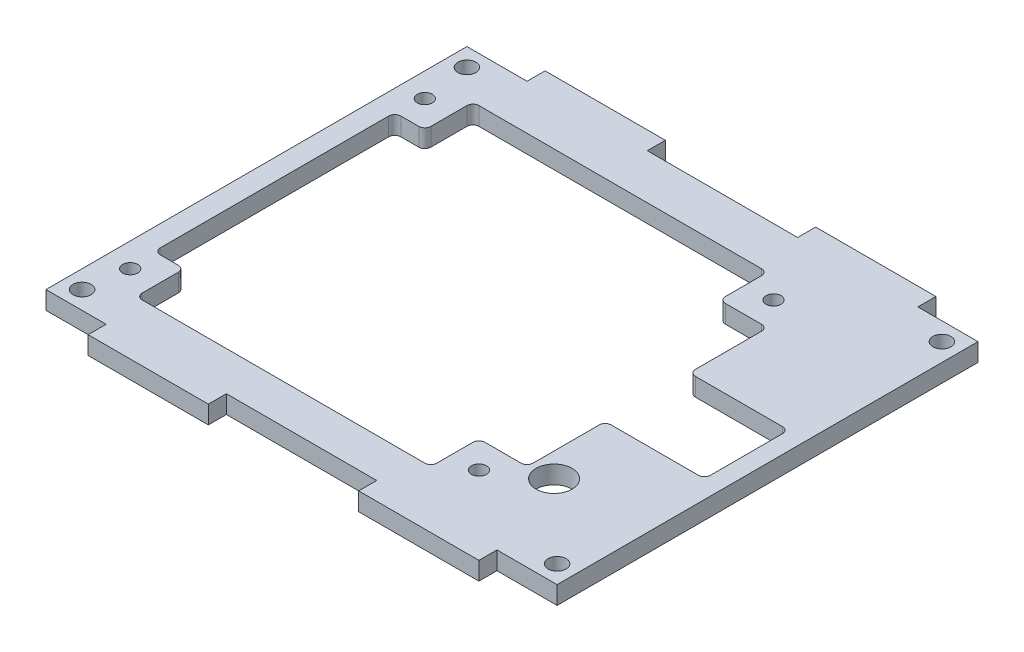
from build123d import *

# Parameters (mm, degrees)
SKETCH1_W           = 85
SKETCH1_H           = 70
BOSS_EXTRUDE1_DEPTH = 3
SKETCH2_R           = 1.25
CUT_EXTRUDE1_DEPTH  = 56.138462075
SKETCH3_W           = 20
SKETCH3_H           = 3
BOSS_EXTRUDE2_DEPTH = 3
SKETCH4_R           = 1.5
CUT_EXTRUDE2_DEPTH  = 10
CUT_EXTRUDE3_DEPTH  = 10
FILLET1_R           = 1
SKETCH6_W           = 16.5
SKETCH6_H           = 14
CUT_EXTRUDE4_DEPTH  = 58.089841478
FILLET2_R           = 1
SKETCH11_R          = 3
CUT_EXTRUDE9_DEPTH  = 10


with BuildPart() as part:
    # Sketch1 → Boss-Extrude1 (new body)
    with BuildSketch(Plane(origin=(0, 0, 0), x_dir=(1, 0, 0), z_dir=(0, 1, 0))):
        Rectangle(SKETCH1_W, SKETCH1_H)
    extrude(amount=BOSS_EXTRUDE1_DEPTH)

    # Sketch2 → Cut-Extrude1 (cut, through all)
    with BuildSketch(Plane(origin=(0, 3, 0), x_dir=(1, 0, 0), z_dir=(0, 1, 0))):
        with Locations(Location((-38.5, 24, 0), (0, 0, 270))):
            Circle(SKETCH2_R)
        with Locations(Location((-38.5, -25, 0), (0, 0, 270))):
            Circle(SKETCH2_R)
        with Locations(Location((19.5, -25, 0), (0, 0, 270))):
            Circle(SKETCH2_R)
        with Locations(Location((19.5, 24, 0), (0, 0, 270))):
            Circle(SKETCH2_R)
    extrude(amount=-CUT_EXTRUDE1_DEPTH, mode=Mode.SUBTRACT)

    # Sketch3 → Boss-Extrude2 (add)
    with BuildSketch(Plane(origin=(0, 3, 0), x_dir=(1, 0, 0), z_dir=(0, 1, 0))):
        with Locations((-22.5, 36.5)):
            Rectangle(SKETCH3_W, SKETCH3_H)
        with Locations((22.5, 36.5)):
            Rectangle(SKETCH3_W, SKETCH3_H)
        with Locations((22.5, -36.5)):
            Rectangle(SKETCH3_W, SKETCH3_H)
        with Locations((-22.5, -36.5)):
            Rectangle(SKETCH3_W, SKETCH3_H)
    extrude(amount=-BOSS_EXTRUDE2_DEPTH)

    # Sketch4 → Cut-Extrude2 (cut)
    with BuildSketch(Plane(origin=(0, 3, 0), x_dir=(1, 0, 0), z_dir=(0, 1, 0))):
        with Locations(Location((-39.5, -32, 0), (0, 0, 270))):
            Circle(SKETCH4_R)
        with Locations(Location((39.5, -32, 0), (0, 0, 270))):
            Circle(SKETCH4_R)
        with Locations(Location((39.5, 32, 0), (0, 0, 270))):
            Circle(SKETCH4_R)
        with Locations(Location((-39.5, 32, 0), (0, 0, 270))):
            Circle(SKETCH4_R)
    extrude(amount=-CUT_EXTRUDE2_DEPTH, mode=Mode.SUBTRACT)

    # Sketch5 → Cut-Extrude3 (cut)
    with BuildSketch(Plane(origin=(0, 3, 0), x_dir=(1, 0, 0), z_dir=(0, 1, 0))):
        Polygon((-34, 27.5), (-34, 19.5), (-39, 19.5), (-39, -20.5), (-34, -20.5), (-34, -28.5), (15, -28.5), (15, -20.5), (23, -20.5), (23, 19.5), (15, 19.5), (15, 27.5), align=None)
    extrude(amount=-CUT_EXTRUDE3_DEPTH, mode=Mode.SUBTRACT)

    # Fillet1
    fillet1_edges = [part.edges().sort_by_distance(p)[0] for p in [
        (-34, 1.5, 20.5),
        (-39, 1.5, 20.5),
        (-39, 1.5, -19.5),
        (-34, 1.5, -19.5),
        (-34, 1.5, -27.5),
        (15, 1.5, -27.5),
        (15, 1.5, -19.5),
        (23, 1.5, -19.5),
        (23, 1.5, 20.5),
        (15, 1.5, 20.5),
        (15, 1.5, 28.5),
        (-34, 1.5, 28.5),
    ]]
    fillet(fillet1_edges, radius=FILLET1_R)

    # Sketch6 → Cut-Extrude4 (cut, through all)
    with BuildSketch(Plane(origin=(0, 3, 0), x_dir=(1, 0, 0), z_dir=(0, 1, 0))):
        with Locations((31.25, -0.5)):
            Rectangle(SKETCH6_W, SKETCH6_H)
    extrude(amount=-CUT_EXTRUDE4_DEPTH, mode=Mode.SUBTRACT)

    # Fillet2
    fillet2_edges = [part.edges().sort_by_distance(p)[0] for p in [
        (23, 1.5, 7.5),
        (23, 1.5, -6.5),
        (39.5, 1.5, -6.5),
        (39.5, 1.5, 7.5),
    ]]
    fillet(fillet2_edges, radius=FILLET2_R)

    # Sketch11 → Cut-Extrude9 (cut)
    with BuildSketch(Plane(origin=(0, 3, 0), x_dir=(1, 0, 0), z_dir=(0, 1, 0))):
        with Locations(Location((27, -20, 0), (0, 0, 270))):
            Circle(SKETCH11_R)
    extrude(amount=-CUT_EXTRUDE9_DEPTH, mode=Mode.SUBTRACT)


solid = part.part
